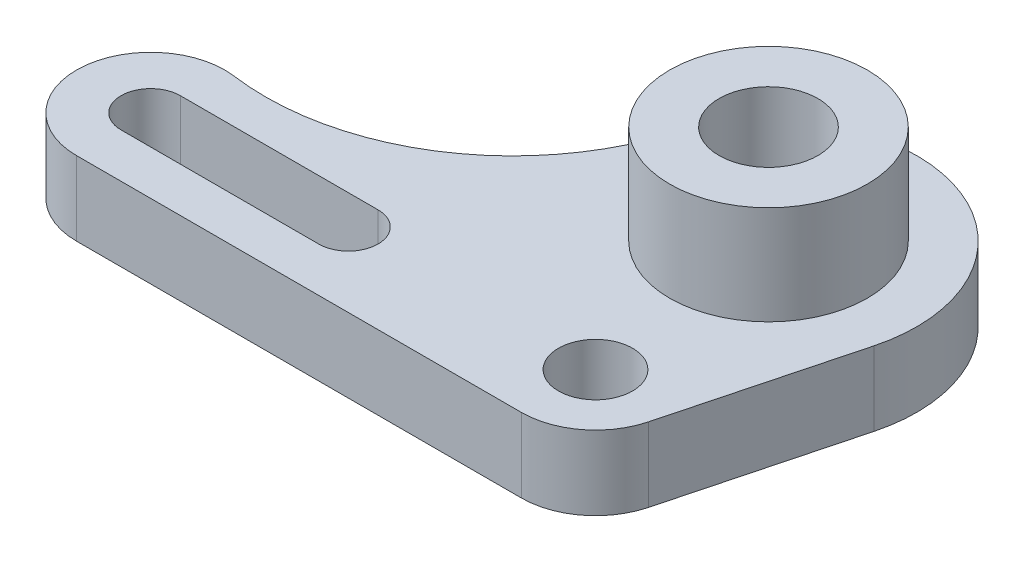
from build123d import *

# Parameters (mm, degrees)
BOSS_EXTRUDE1_DEPTH = 15
SKETCH2_R           = 20
SKETCH2_R_2         = 10
BOSS_EXTRUDE2_DEPTH = 20
SKETCH5_R           = 7.5
CUT_EXTRUDE1_DEPTH  = 116.866302263
CUT_EXTRUDE2_DEPTH  = 116.866302263


with BuildPart() as part:
    # Sketch1 → Boss-Extrude1 (new body)
    with BuildSketch(Plane(origin=(0, 0, 0), x_dir=(1, 0, 0), z_dir=(0, 1, 0))):
        with BuildLine():
            Line((-85, -55), (5, -55))
            ThreePointArc((5, -55), (14.16042736, -51.877986807), (19.507658043, -43.811542745))
            Line((19.507658043, -43.811542745), (29.015316087, -7.623085489))
            ThreePointArc((29.015316087, -7.623085489), (8.389479092, 28.803066513), (-28.570577696, 9.149977603))
            ThreePointArc((-28.570577696, 9.149977603), (-49.525739839, -17.897965522), (-82.966509351, -25.138475321))
            ThreePointArc((-82.966509351, -25.138475321), (-99.965341128, -38.980899952), (-85, -55))
        make_face()
    extrude(amount=BOSS_EXTRUDE1_DEPTH)

    # Sketch2 → Boss-Extrude2 (add)
    with BuildSketch(Plane(origin=(0, 15, 0), x_dir=(1, 0, 0), z_dir=(0, 1, 0))):
        Circle(SKETCH2_R)
        Circle(SKETCH2_R_2, mode=Mode.SUBTRACT)
    extrude(amount=BOSS_EXTRUDE2_DEPTH)

    # Sketch5 → Cut-Extrude1 (cut, through all)
    with BuildSketch(Plane(origin=(0, 15, 0), x_dir=(1, 0, 0), z_dir=(0, 1, 0))):
        with Locations((5, -40)):
            Circle(SKETCH5_R)
    extrude(amount=-CUT_EXTRUDE1_DEPTH, mode=Mode.SUBTRACT)

    # Sketch6 → Cut-Extrude2 (cut, through all)
    with BuildSketch(Plane(origin=(0, 15, 0), x_dir=(1, 0, 0), z_dir=(0, 1, 0))):
        with BuildLine():
            Line((-85, -34), (-45, -34))
            ThreePointArc((-45, -34), (-39, -40), (-45, -46))
            Line((-45, -46), (-85, -46))
            ThreePointArc((-85, -46), (-91, -40), (-85, -34))
        make_face()
    extrude(amount=-CUT_EXTRUDE2_DEPTH, mode=Mode.SUBTRACT)


solid = part.part
